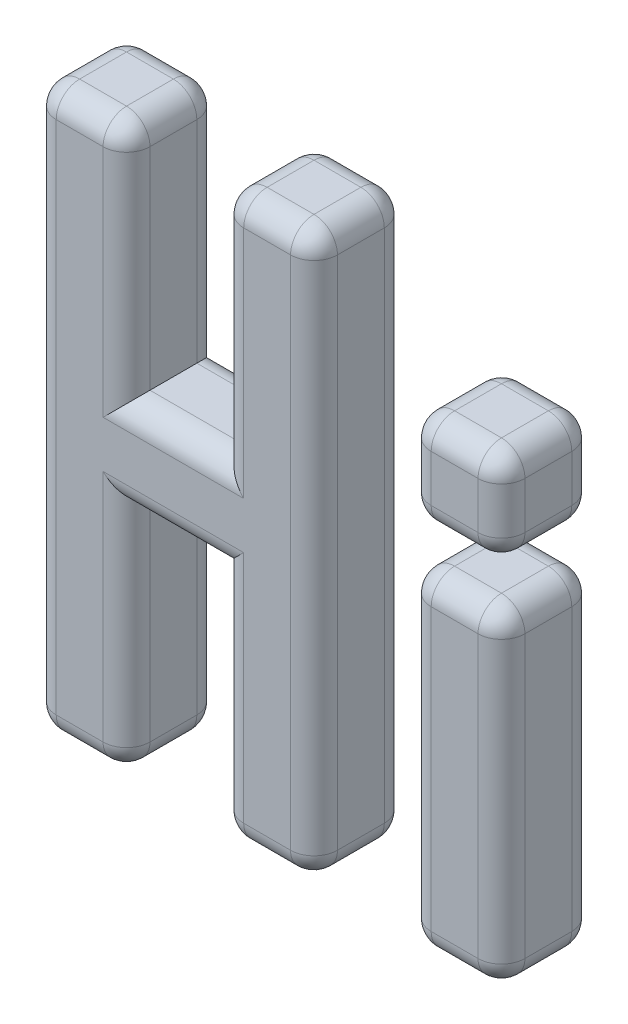
from build123d import *

# Parameters (mm, degrees)
BOSS_EXTRUDE1_DEPTH   = 10
SKETCH1_W             = 10
SKETCH1_H             = 10
BOSS_EXTRUDE1_2_DEPTH = 10
SKETCH1_H_2           = 35
BOSS_EXTRUDE1_3_DEPTH = 10
FILLET2_R             = 2.5
FILLET3_R             = 2.5
FILLET4_R             = 2.5
FILLET5_R             = 2.5
FILLET6_R             = 2.5
FILLET7_R             = 2.5
FILLET8_R             = 2.5
FILLET9_R             = 2.5
FILLET10_R            = 2.5
FILLET11_R            = 2.5
FILLET12_R            = 2.5
FILLET13_R            = 2.5
FILLET14_R            = 2.5
FILLET15_R            = 2.5
FILLET16_R            = 2.5
FILLET17_R            = 2.5
FILLET18_R            = 2.5
FILLET19_R            = 2.5
FILLET20_R            = 2.5
FILLET21_R            = 2.5
FILLET22_R            = 2.5
FILLET23_R            = 2.5
FILLET24_R            = 2.5


with BuildPart() as part:
    # Sketch1 → Boss-Extrude1 (new body)
    with BuildSketch(Plane.XY):
        Polygon((-86.338028169, -9.718309859), (-86.338028169, 15.281690141), (-76.338028169, 15.281690141), (-76.338028169, -9.718309859), (-66.338028169, -9.718309859), (-66.338028169, 15.281690141), (-66.338028169, 25.281690141), (-66.338028169, 50.281690141), (-76.338028169, 50.281690141), (-76.338028169, 25.281690141), (-86.338028169, 25.281690141), (-86.338028169, 50.281690141), (-96.338028169, 50.281690141), (-96.338028169, 25.281690141), (-96.338028169, 15.281690141), (-96.338028169, -9.718309859), align=None)
    extrude(amount=BOSS_EXTRUDE1_DEPTH)

    # Fillet2
    fillet2_edges = [part.edges().sort_by_distance(p)[0] for p in [
        (-96.338028169, 50.281690141, 5),
    ]]
    fillet(fillet2_edges, radius=FILLET2_R)

    # Fillet3
    fillet3_edges = [part.edges().sort_by_distance(p)[0] for p in [
        (-86.338028169, 50.281690141, 5),
    ]]
    fillet(fillet3_edges, radius=FILLET3_R)

    # Fillet4
    fillet4_edges = [part.edges().sort_by_distance(p)[0] for p in [
        (-66.338028169, 50.281690141, 5),
    ]]
    fillet(fillet4_edges, radius=FILLET4_R)

    # Fillet5
    fillet5_edges = [part.edges().sort_by_distance(p)[0] for p in [
        (-76.338028169, 50.281690141, 5),
    ]]
    fillet(fillet5_edges, radius=FILLET5_R)

    # Fillet6
    fillet6_edges = [part.edges().sort_by_distance(p)[0] for p in [
        (-96.338028169, -9.718309859, 5),
    ]]
    fillet(fillet6_edges, radius=FILLET6_R)

    # Fillet7
    fillet7_edges = [part.edges().sort_by_distance(p)[0] for p in [
        (-86.338028169, -9.718309859, 5),
    ]]
    fillet(fillet7_edges, radius=FILLET7_R)

    # Fillet9
    fillet9_edges = [part.edges().sort_by_distance(p)[0] for p in [
        (-66.338028169, -9.718309859, 5),
    ]]
    fillet(fillet9_edges, radius=FILLET9_R)

    # Fillet10
    fillet10_edges = [part.edges().sort_by_distance(p)[0] for p in [
        (-76.338028169, -9.718309859, 5),
    ]]
    fillet(fillet10_edges, radius=FILLET10_R)

    # Fillet16
    fillet16_edges = [part.edges().sort_by_distance(p)[0] for p in [
        (-96.338028169, 20.281690141, 10),
        (-91.338028169, 50.281690141, 10),
        (-95.605795122, 49.549457094, 10),
        (-86.338028169, 36.531690141, 10),
        (-87.070261216, 49.549457094, 10),
        (-86.338028169, 4.031690141, 10),
        (-91.338028169, -9.718309859, 10),
        (-95.605795122, -8.986076812, 10),
        (-87.070261216, -8.986076812, 10),
    ]]
    fillet(fillet16_edges, radius=FILLET16_R)

    # Fillet17
    fillet17_edges = [part.edges().sort_by_distance(p)[0] for p in [
        (-76.338028169, 4.031690141, 10),
        (-66.338028169, 20.281690141, 10),
        (-67.070261216, 49.549457094, 10),
        (-76.338028169, 36.531690141, 10),
        (-71.338028169, 50.281690141, 10),
        (-75.605795122, 49.549457094, 10),
        (-67.070261216, -8.986076812, 10),
        (-71.338028169, -9.718309859, 10),
        (-75.605795122, -8.986076812, 10),
    ]]
    fillet(fillet17_edges, radius=FILLET17_R)

    # Fillet22
    fillet22_edges = [part.edges().sort_by_distance(p)[0] for p in [
        (-86.338028169, 36.531690141, 0),
        (-87.070261216, 49.549457094, 0),
        (-91.338028169, 50.281690141, 0),
        (-95.605795122, 49.549457094, 0),
        (-86.338028169, 4.031690141, 0),
        (-87.070261216, -8.986076812, 0),
        (-91.338028169, -9.718309859, 0),
        (-95.605795122, -8.986076812, 0),
        (-76.338028169, 36.531690141, 0),
        (-75.605795122, 49.549457094, 0),
        (-67.070261216, 49.549457094, 0),
        (-76.338028169, 4.031690141, 0),
        (-75.605795122, -8.986076812, 0),
        (-71.338028169, -9.718309859, 0),
        (-67.070261216, -8.986076812, 0),
        (-96.338028169, 20.281690141, 0),
        (-66.338028169, 20.281690141, 0),
    ]]
    fillet(fillet22_edges, radius=FILLET22_R)

    # Fillet23
    fillet23_edges = [part.edges().sort_by_distance(p)[0] for p in [
        (-81.338028169, 15.281690141, 0),
        (-81.338028169, 25.281690141, 0),
    ]]
    fillet(fillet23_edges, radius=FILLET23_R)

    # Fillet24
    fillet24_edges = [part.edges().sort_by_distance(p)[0] for p in [
        (-81.338028169, 15.281690141, 10),
        (-81.338028169, 25.281690141, 10),
    ]]
    fillet(fillet24_edges, radius=FILLET24_R)


with BuildPart() as body_2:
    # Sketch1 → Boss-Extrude1 2 (new body)
    with BuildSketch(Plane.XY):
        with Locations((-51.338028169, 34.633802817)):
            Rectangle(SKETCH1_W, SKETCH1_H)
    extrude(amount=BOSS_EXTRUDE1_2_DEPTH)

    # Fillet13
    fillet13_edges = [body_2.edges().sort_by_distance(p)[0] for p in [
        (-46.338028169, 29.633802817, 5),
    ]]
    fillet(fillet13_edges, radius=FILLET13_R)

    # Fillet14
    fillet14_edges = [body_2.edges().sort_by_distance(p)[0] for p in [
        (-56.338028169, 29.633802817, 5),
        (-56.338028169, 39.633802817, 5),
        (-46.338028169, 39.633802817, 5),
    ]]
    fillet(fillet14_edges, radius=FILLET14_R)

    # Fillet19
    fillet19_edges = [body_2.edges().sort_by_distance(p)[0] for p in [
        (-47.070261216, 30.366035864, 10),
        (-51.338028169, 29.633802817, 10),
        (-56.338028169, 34.633802817, 10),
        (-46.338028169, 34.633802817, 10),
        (-51.338028169, 39.633802817, 10),
        (-47.070261216, 38.90156977, 10),
        (-55.605795122, 38.90156977, 10),
        (-55.605795122, 30.366035864, 10),
    ]]
    fillet(fillet19_edges, radius=FILLET19_R)

    # Fillet20
    fillet20_edges = [body_2.edges().sort_by_distance(p)[0] for p in [
        (-47.070261216, 30.366035864, 0),
        (-51.338028169, 29.633802817, 0),
        (-46.338028169, 34.633802817, 0),
        (-56.338028169, 34.633802817, 0),
        (-51.338028169, 39.633802817, 0),
        (-47.070261216, 38.90156977, 0),
        (-55.605795122, 38.90156977, 0),
        (-55.605795122, 30.366035864, 0),
    ]]
    fillet(fillet20_edges, radius=FILLET20_R)


with BuildPart() as body_3:
    # Sketch1 → Boss-Extrude1 3 (new body)
    with BuildSketch(Plane.XY):
        with Locations((-51.338028169, 7.781690141)):
            Rectangle(SKETCH1_W, SKETCH1_H_2)
    extrude(amount=BOSS_EXTRUDE1_3_DEPTH)

    # Fillet8
    fillet8_edges = [body_3.edges().sort_by_distance(p)[0] for p in [
        (-46.338028169, -9.718309859, 5),
    ]]
    fillet(fillet8_edges, radius=FILLET8_R)

    # Fillet11
    fillet11_edges = [body_3.edges().sort_by_distance(p)[0] for p in [
        (-56.338028169, -9.718309859, 5),
    ]]
    fillet(fillet11_edges, radius=FILLET11_R)

    # Fillet12
    fillet12_edges = [body_3.edges().sort_by_distance(p)[0] for p in [
        (-46.338028169, 25.281690141, 5),
    ]]
    fillet(fillet12_edges, radius=FILLET12_R)

    # Fillet15
    fillet15_edges = [body_3.edges().sort_by_distance(p)[0] for p in [
        (-56.338028169, 25.281690141, 5),
    ]]
    fillet(fillet15_edges, radius=FILLET15_R)

    # Fillet18
    fillet18_edges = [body_3.edges().sort_by_distance(p)[0] for p in [
        (-47.070261216, -8.986076812, 10),
        (-51.338028169, -9.718309859, 10),
        (-55.605795122, -8.986076812, 10),
        (-46.338028169, 7.781690141, 10),
        (-47.070261216, 24.549457094, 10),
        (-56.338028169, 7.781690141, 10),
        (-51.338028169, 25.281690141, 10),
        (-55.605795122, 24.549457094, 10),
    ]]
    fillet(fillet18_edges, radius=FILLET18_R)

    # Fillet21
    fillet21_edges = [body_3.edges().sort_by_distance(p)[0] for p in [
        (-47.070261216, -8.986076812, 0),
        (-51.338028169, -9.718309859, 0),
        (-55.605795122, -8.986076812, 0),
        (-46.338028169, 7.781690141, 0),
        (-47.070261216, 24.549457094, 0),
        (-56.338028169, 7.781690141, 0),
        (-51.338028169, 25.281690141, 0),
        (-55.605795122, 24.549457094, 0),
    ]]
    fillet(fillet21_edges, radius=FILLET21_R)


solid = Compound([part.part, body_2.part, body_3.part])
